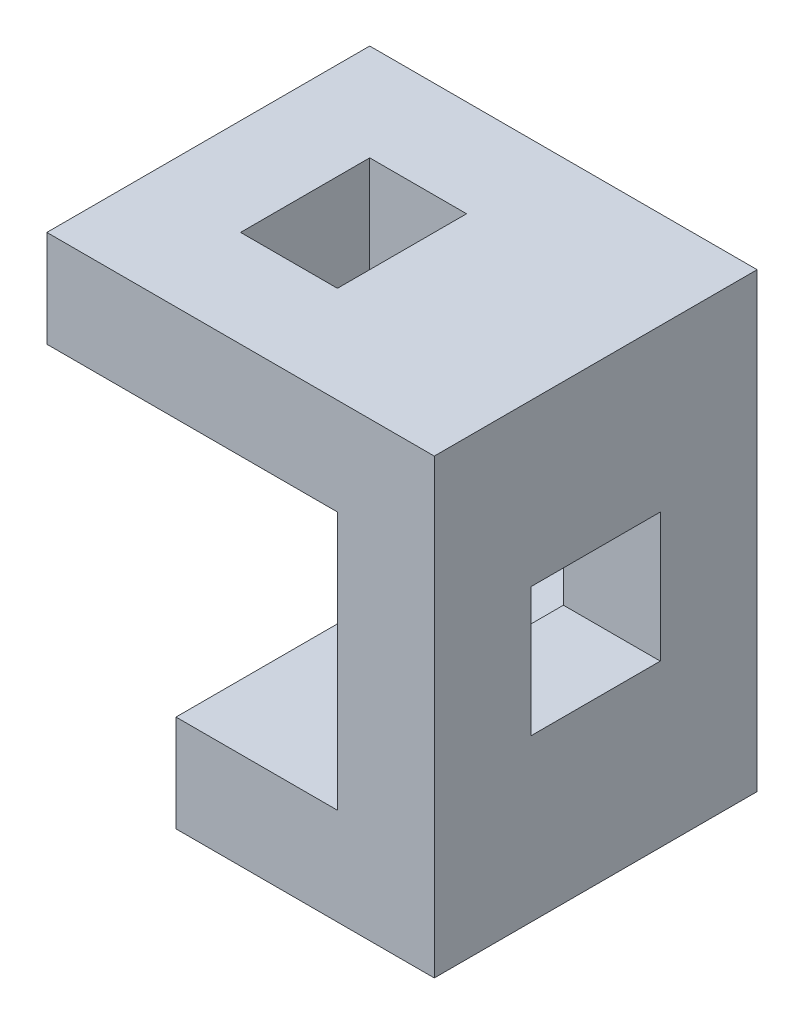
from build123d import *

# Parameters (mm, degrees)
RESSALTO_EXTRUS_O1_DEPTH = 50
ESBO_O2_W                = 20
ESBO_O2_H                = 20
CORTE_EXTRUS_O1_DEPTH    = 50
ESBO_O4_W                = 15
ESBO_O4_H                = 20
CORTE_EXTRUS_O2_DEPTH    = 50


with BuildPart() as part:
    # Esboço1 → Ressalto-extrusão1 (new body)
    with BuildSketch(Plane.XY):
        Polygon((-60, 0), (0, 0), (0, -70), (-40, -70), (-40, -55), (-15, -55), (-15, -15), (-60, -15), align=None)
    extrude(amount=RESSALTO_EXTRUS_O1_DEPTH)

    # Esboço2 → Corte-extrusão1 (cut)
    with BuildSketch(Plane.ZY.offset(15)):
        with Locations((25, -35)):
            Rectangle(ESBO_O2_W, ESBO_O2_H)
    extrude(amount=-CORTE_EXTRUS_O1_DEPTH, mode=Mode.SUBTRACT)

    # Esboço4 → Corte-extrusão2 (cut)
    with BuildSketch(Plane(origin=(0, 0, 0), x_dir=(1, 0, 0), z_dir=(0, 1, 0))):
        with Locations((-37.5, -25)):
            Rectangle(ESBO_O4_W, ESBO_O4_H)
    extrude(amount=-CORTE_EXTRUS_O2_DEPTH, mode=Mode.SUBTRACT)


solid = part.part
